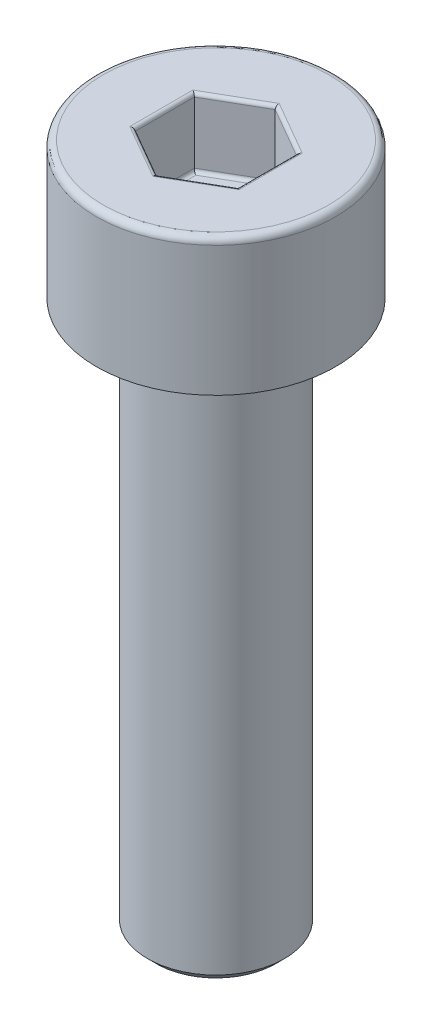
from build123d import *

# Parameters (mm, degrees)
CHAMFER1_SIZE      = 0.25
FILLET1_R          = 0.2
CUT_EXTRUDE1_DEPTH = 2
FILLET2_R          = 0.1


with BuildPart() as part:
    # Sketch1 → Revolve1 (revolve)
    with BuildSketch(Plane.XY, mode=Mode.PRIVATE) as revolve1_sk:
        Polygon((0, -20), (-2, -20), (-2, -4), (-3.5, -4), (-3.5, 0), (0, 0), align=None)
    revolve(revolve1_sk.sketch.rotate(Axis((0, 0, 0), (0, -1, 0)), 270), axis=Axis((0, 0, 0), (0, -1, 0)))

    # Chamfer1
    chamfer1_edges = [part.edges().sort_by_distance(p)[0] for p in [
        (0, -4, -2),
        (0, -20, -2),
    ]]
    chamfer(chamfer1_edges, length=CHAMFER1_SIZE)

    # Fillet1
    fillet1_edges = [part.edges().sort_by_distance(p)[0] for p in [
        (0, 0, -3.5),
    ]]
    fillet(fillet1_edges, radius=FILLET1_R)

    # Sketch2 → Cut-Extrude1 (cut)
    with BuildSketch(Plane(origin=(0, 0, 0), x_dir=(1, 0, 0), z_dir=(0, 1, 0))):
        Polygon((0, 1.732050808), (-1.5, 0.866025404), (-1.5, -0.866025404), (0, -1.732050808), (1.5, -0.866025404), (1.5, 0.866025404), align=None)
    extrude(amount=-CUT_EXTRUDE1_DEPTH, mode=Mode.SUBTRACT)

    # Fillet2
    fillet2_edges = [part.edges().sort_by_distance(p)[0] for p in [
        (0.75, -2, -1.299038106),
        (1.5, -2, 0),
        (0.75, -2, 1.299038106),
        (-0.75, -2, 1.299038106),
        (-1.5, -2, 0),
        (-0.75, -2, -1.299038106),
        (0.75, 0, -1.299038106),
        (-0.75, 0, -1.299038106),
        (-1.5, 0, 0),
        (-0.75, 0, 1.299038106),
        (0.75, 0, 1.299038106),
        (1.5, 0, 0),
    ]]
    fillet(fillet2_edges, radius=FILLET2_R)


solid = part.part
